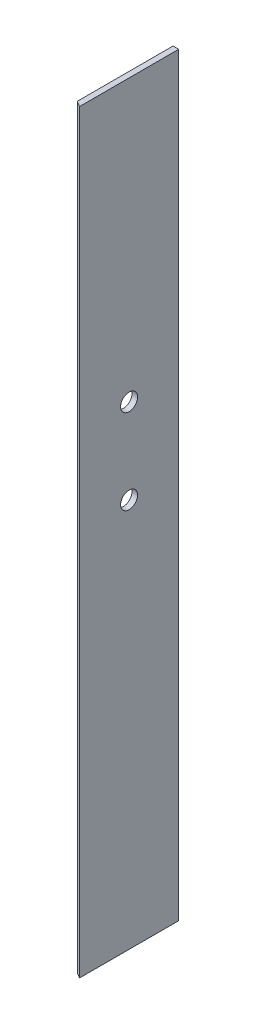
from build123d import *

# Parameters (mm, degrees)
EXTRUDE_1_DEPTH    = 533.213673317
SKETCH1_R          = 6
CUT_EXTRUDE1_DEPTH = 538.812661937


with BuildPart() as part:
    # Эскиз1 → Вытянуть1 (new body)
    with BuildSketch(Plane(origin=(0, 0, 0), x_dir=(1, 0, 0), z_dir=(0, 1, 0))):
        Polygon((1, 0), (5, 0), (5, -70.068808523), (1, -67.636001514), align=None)
    extrude(amount=EXTRUDE_1_DEPTH)

    # Sketch1 → Cut-Extrude1 (cut, through all)
    with BuildSketch(Plane(origin=(5, 0, 0), x_dir=(0, 0, -1), z_dir=(1, 0, 0))):
        with Locations((-35.034404262, 335)):
            Circle(SKETCH1_R)
        with Locations((-35.034404262, 275)):
            Circle(SKETCH1_R)
    extrude(amount=-CUT_EXTRUDE1_DEPTH, mode=Mode.SUBTRACT)


solid = part.part
